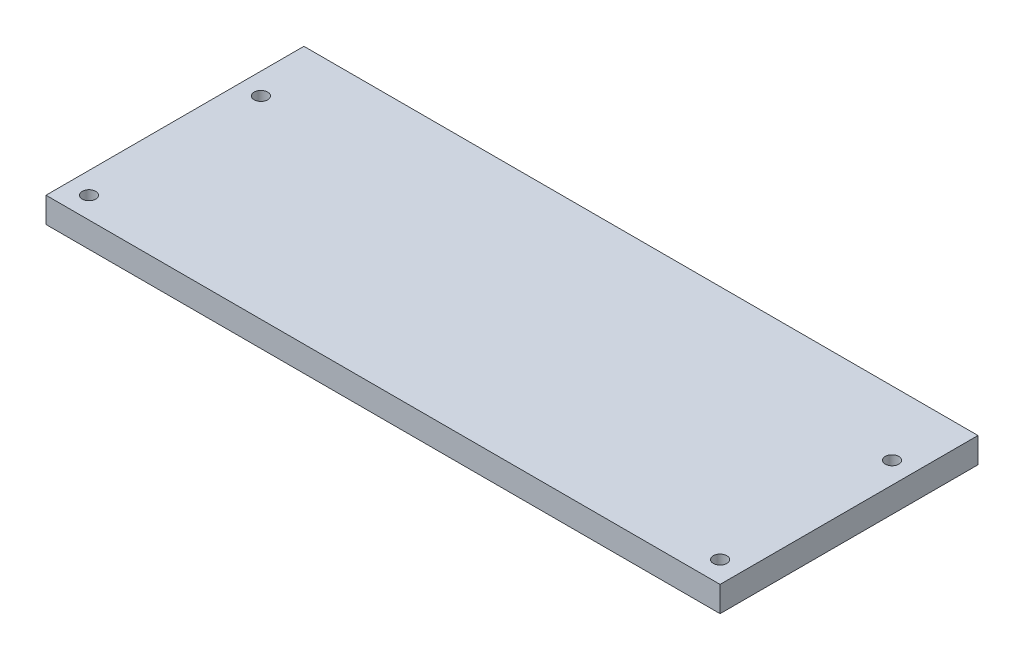
from build123d import *

# Parameters (mm, degrees)
SKETCH_1_W      = 398.3
SKETCH_1_H      = 152.4
SKETCH_1_R      = 4
EXTRUDE_1_DEPTH = 15


with BuildPart() as part:
    # 草图1 → 凸台-拉伸1 (new body)
    with BuildSketch(Plane(origin=(0, 0, 0), x_dir=(1, 0, 0), z_dir=(0, 1, 0))):
        with Locations((199.15, 76.2)):
            Rectangle(SKETCH_1_W, SKETCH_1_H)
        with Locations(Location((12.7, 114.3, 0), (0, 0, 270))):
            Circle(SKETCH_1_R, mode=Mode.SUBTRACT)
        with Locations(Location((12.7, 12.7, 0), (0, 0, 270))):
            Circle(SKETCH_1_R, mode=Mode.SUBTRACT)
        with Locations(Location((385.6, 114.3, 0), (0, 0, 270))):
            Circle(SKETCH_1_R, mode=Mode.SUBTRACT)
        with Locations(Location((385.6, 12.7, 0), (0, 0, 270))):
            Circle(SKETCH_1_R, mode=Mode.SUBTRACT)
    extrude(amount=EXTRUDE_1_DEPTH)


solid = part.part
